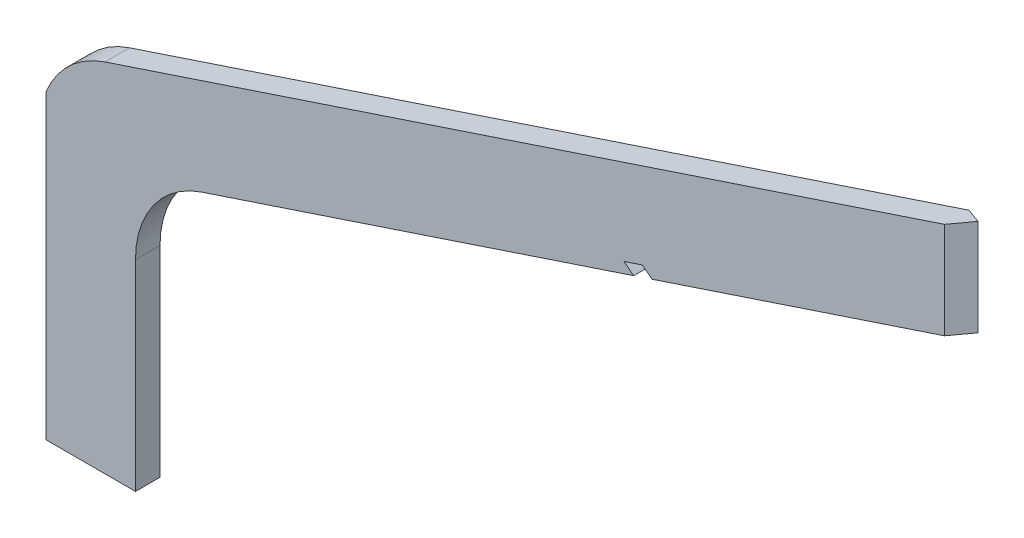
from build123d import *

# Parameters (mm, degrees)
BOSS_EXTRUDE1_DEPTH      = 3.175
BOSS_EXTRUDE1_DEPTH_BACK = 3.175
CUT_EXTRUDE3_DEPTH       = 206.528461822
CUT_EXTRUDE5_DEPTH       = 206.528461822
CUT_EXTRUDE6_DEPTH       = 6.35


with BuildPart() as part:
    # Sketch1 → Boss-Extrude1 (new, two sides: drawn at the far end of the back side and taken through both)
    with BuildSketch(Plane.XY.offset(-BOSS_EXTRUDE1_DEPTH_BACK)):
        with BuildLine():
            Line((-95.480291898, -80.706386575), (-95.480291898, -131.085242165))
            Line((-95.480291898, -131.085242165), (-95.480291898, -132.672742165))
            Line((-95.480291898, -132.672742165), (-120.480291898, -132.672742165))
            Line((-120.480291898, -132.672742165), (-120.480291898, -131.085242165))
            Line((-120.480291898, -131.085242165), (-120.480291898, -64.018285781))
            ThreePointArc((-120.480291898, -64.018285781), (-115.755703828, -49.392703021), (-103.367678212, -40.295108567))
            Line((-103.367678212, -40.295108567), (119.519708102, 33.809591006))
            Line((119.519708102, 33.809591006), (119.519708102, 8.809591006))
            Line((119.519708102, 8.809591006), (-78.367678212, -56.983209361))
            ThreePointArc((-78.367678212, -56.983209361), (-90.755703828, -66.080803815), (-95.480291898, -80.706386575))
        make_face()
    extrude(amount=BOSS_EXTRUDE1_DEPTH + BOSS_EXTRUDE1_DEPTH_BACK)

    # Sketch2 → Cut-Extrude3 (cut, through all)
    with BuildSketch(Plane.XZ.offset(132.672742165)):
        Polygon((-120.480291898, 0), (-120.480291898, 3.175), (-118.647204793, 3.175), align=None)
    cut_extrude3 = extrude(amount=-CUT_EXTRUDE3_DEPTH, mode=Mode.SUBTRACT)

    # Mirror3: Cut-Extrude3 across plane
    add(cut_extrude3.mirror(Plane.XY), mode=Mode.SUBTRACT)

    # Sketch3 → Cut-Extrude5 (cut, through all)
    with BuildSketch(Plane.XZ.offset(132.672742165)):
        Polygon((119.519708102, 3.175), (114.020446788, 3.175), (119.519708102, 0), align=None)
    cut_extrude5 = extrude(amount=-CUT_EXTRUDE5_DEPTH, mode=Mode.SUBTRACT)

    # Mirror4: Cut-Extrude5 across plane
    add(cut_extrude5.mirror(Plane.XY), mode=Mode.SUBTRACT)

    # Sketch6 → Cut-Extrude6 (cut)
    with BuildSketch(Plane.XY.offset(3.175)):
        Polygon((33.546459297, -19.774448133), (38.29109474, -18.19697087), (35.769730347, -16.267373348), (31.025094904, -17.844850611), align=None)
    extrude(amount=-CUT_EXTRUDE6_DEPTH, mode=Mode.SUBTRACT)


solid = part.part
